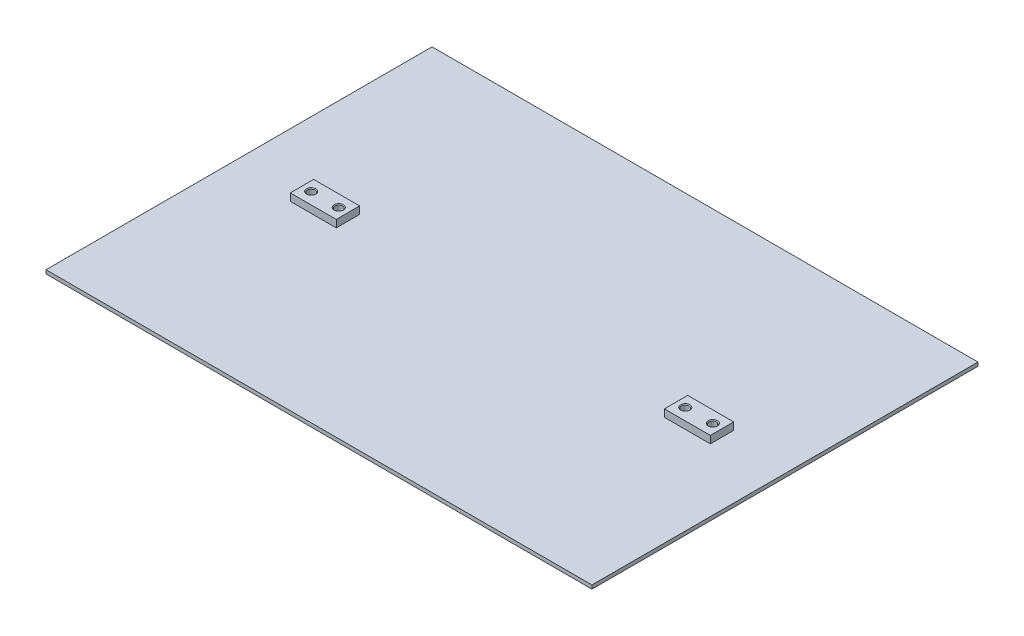
from build123d import *

# Parameters (mm, degrees)
SKETCH1_W                   = 297
SKETCH1_H                   = 210
BOSS_EXTRUDE1_DEPTH         = 2
SKETCH4_W                   = 25
SKETCH4_H                   = 12.7
BOSS_EXTRUDE2_DEPTH         = 4
M5_TAPPED_HOLE1_D           = 4.2
M5_TAPPED_HOLE1_CSINK_D     = 5.05
M5_TAPPED_HOLE1_CSINK_ANGLE = 90


with BuildPart() as part:
    # Sketch1 → Boss-Extrude1 (new body)
    with BuildSketch(Plane(origin=(0, 0, 0), x_dir=(1, 0, 0), z_dir=(0, 1, 0))):
        Rectangle(SKETCH1_W, SKETCH1_H)
    extrude(amount=BOSS_EXTRUDE1_DEPTH)

    # Sketch4 → Boss-Extrude2 (add)
    with BuildSketch(Plane(origin=(0, 2, 0), x_dir=(1, 0, 0), z_dir=(0, 1, 0))):
        with Locations((101.75, 0)):
            Rectangle(SKETCH4_W, SKETCH4_H)
        with Locations((-101.75, 0)):
            Rectangle(SKETCH4_W, SKETCH4_H)
    extrude(amount=BOSS_EXTRUDE2_DEPTH)

    # M5 Tapped Hole1 (through all)
    with Locations(Plane(origin=(0, 6, 0), x_dir=(1, 0, 0), z_dir=(0, 1, 0))):
        with Locations((-109.25, 0), (109.25, 0), (94.25, 0), (-94.25, 0)):
            CounterSinkHole(M5_TAPPED_HOLE1_D / 2, M5_TAPPED_HOLE1_CSINK_D / 2, counter_sink_angle=M5_TAPPED_HOLE1_CSINK_ANGLE)


solid = part.part
